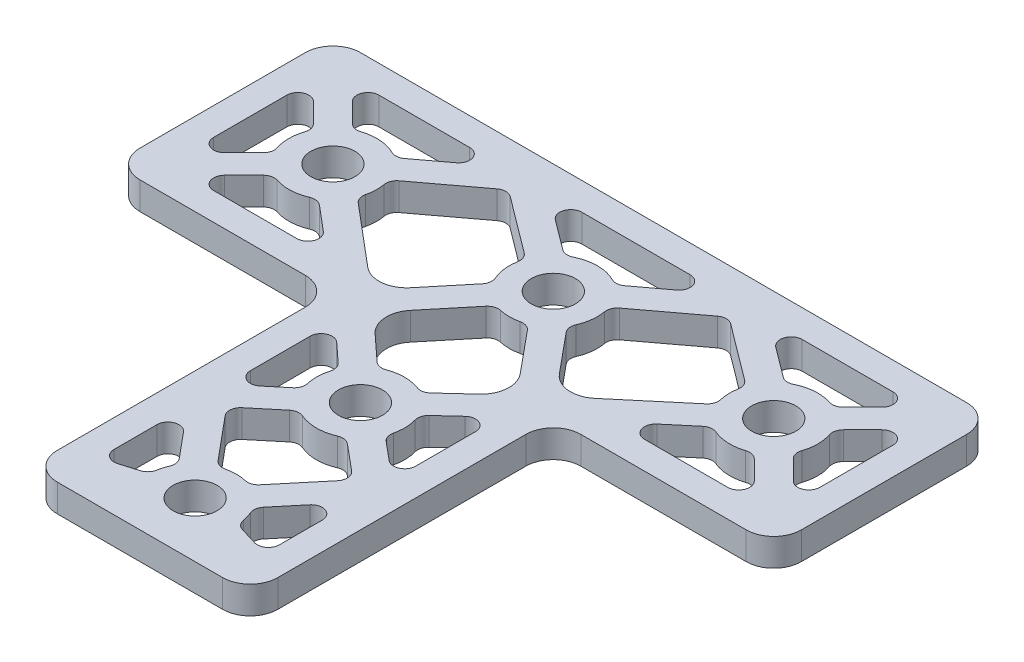
from build123d import *

# Parameters (mm, degrees)
SKETCH1_R           = 2.54
BOSS_EXTRUDE1_DEPTH = 3.175
CUT_EXTRUDE1_DEPTH  = 84.882514567
FILLET1_R           = 1.27
FILLET2_R           = 3.175


with BuildPart() as part:
    # Sketch1 → Boss-Extrude1 (new body)
    with BuildSketch(Plane(origin=(0, 0, 0), x_dir=(1, 0, 0), z_dir=(0, 1, 0))):
        with BuildLine():
            Line((0, 3.175), (0, 22.225))
            ThreePointArc((0, 22.225), (0.92993597, 24.47006403), (3.175, 25.4))
            Line((3.175, 25.4), (73.025, 25.4))
            ThreePointArc((73.025, 25.4), (75.27006403, 24.47006403), (76.2, 22.225))
            Line((76.2, 22.225), (76.2, 3.175))
            ThreePointArc((76.2, 3.175), (75.27006403, 0.92993597), (73.025, 0))
            Line((73.025, 0), (53.975, 0))
            ThreePointArc((53.975, 0), (51.72993597, -0.92993597), (50.8, -3.175))
            Line((50.8, -3.175), (50.8, -31.75))
            ThreePointArc((50.8, -31.75), (49.87006403, -33.99506403), (47.625, -34.925))
            Line((47.625, -34.925), (28.575, -34.925))
            ThreePointArc((28.575, -34.925), (26.32993597, -33.99506403), (25.4, -31.75))
            Line((25.4, -31.75), (25.4, -3.175))
            ThreePointArc((25.4, -3.175), (24.47006403, -0.92993597), (22.225, 0))
            Line((22.225, 0), (3.175, 0))
            ThreePointArc((3.175, 0), (0.92993597, 0.92993597), (0, 3.175))
        make_face()
        with Locations(Location((38.1, -9.525, 0), (0, 0, 270))):
            Circle(SKETCH1_R, mode=Mode.SUBTRACT)
        with Locations(Location((38.1, -28.575, 0), (0, 0, 270))):
            Circle(SKETCH1_R, mode=Mode.SUBTRACT)
        with Locations(Location((12.7, 12.7, 0), (0, 0, 270))):
            Circle(SKETCH1_R, mode=Mode.SUBTRACT)
        with Locations(Location((38.1, 12.7, 0), (0, 0, 270))):
            Circle(SKETCH1_R, mode=Mode.SUBTRACT)
        with Locations(Location((63.5, 12.7, 0), (0, 0, 270))):
            Circle(SKETCH1_R, mode=Mode.SUBTRACT)
    extrude(amount=BOSS_EXTRUDE1_DEPTH)

    # Sketch2 → Cut-Extrude1 (cut, through all)
    with BuildSketch(Plane(origin=(0, 3.175, 0), x_dir=(1, 0, 0), z_dir=(0, 1, 0))):
        with BuildLine():
            Line((28.575, -30.092601342), (33.021765741, -28.758571619))
            ThreePointArc((33.021765741, -28.758571619), (33.23547597, -27.428667372), (33.791186263, -26.201677788))
            Line((33.791186263, -26.201677788), (28.575, -19.942254272))
            Line((28.575, -19.942254272), (28.575, -30.092601342))
        make_face()
        with BuildLine():
            ThreePointArc((42.408813737, -26.201677788), (42.96452403, -27.428667372), (43.178234259, -28.758571619))
            Line((43.178234259, -28.758571619), (47.625, -30.092601342))
            Line((47.625, -30.092601342), (47.625, -19.942254272))
            Line((47.625, -19.942254272), (42.408813737, -26.201677788))
        make_face()
        with BuildLine():
            ThreePointArc((36.230288826, -24.169092319), (38.1, -23.8125), (39.969711174, -24.169092319))
            Line((39.969711174, -24.169092319), (45.389155984, -17.665758547))
            Line((45.389155984, -17.665758547), (40.790822212, -13.833813737))
            ThreePointArc((40.790822212, -13.833813737), (38.1, -14.605), (35.409177788, -13.833813737))
            Line((35.409177788, -13.833813737), (30.810844016, -17.665758547))
            Line((30.810844016, -17.665758547), (36.230288826, -24.169092319))
        make_face()
        with BuildLine():
            Line((28.575, -3.175), (28.575, -15.396038107))
            Line((28.575, -15.396038107), (33.376592319, -11.394711174))
            ThreePointArc((33.376592319, -11.394711174), (33.021594752, -9.397720235), (33.476184703, -7.421019939))
            Line((33.476184703, -7.421019939), (28.568882888, -2.896342676))
            ThreePointArc((28.568882888, -2.896342676), (28.573470538, -3.035637771), (28.575, -3.175))
        make_face()
        with BuildLine():
            Line((42.823407681, -11.394711174), (47.625, -15.396038107))
            Line((47.625, -15.396038107), (47.625, -3.175))
            ThreePointArc((47.625, -3.175), (47.626529462, -3.035637771), (47.631117112, -2.896342676))
            Line((47.631117112, -2.896342676), (42.723815297, -7.421019939))
            ThreePointArc((42.723815297, -7.421019939), (43.064644081, -8.44856647), (43.18, -9.525))
            ThreePointArc((43.18, -9.525), (43.090055662, -10.476706094), (42.823407681, -11.394711174))
        make_face()
        with BuildLine():
            Line((29.852647229, 0.238617187), (35.628403644, -5.086800877))
            ThreePointArc((35.628403644, -5.086800877), (38.1, -4.445), (40.571596356, -5.086800877))
            Line((40.571596356, -5.086800877), (46.347352771, 0.238617187))
            Line((46.347352771, 0.238617187), (39.952436997, 7.969791001))
            ThreePointArc((39.952436997, 7.969791001), (38.1, 7.62), (36.247563003, 7.969791001))
            Line((36.247563003, 7.969791001), (29.852647229, 0.238617187))
        make_face()
        with BuildLine():
            Line((17.413562252, 10.805605401), (27.468157851, 2.337260875))
            Line((27.468157851, 2.337260875), (33.801048645, 9.993449198))
            ThreePointArc((33.801048645, 9.993449198), (33.055389198, 12.101416788), (33.287034225, 14.325349331))
            Line((33.287034225, 14.325349331), (25.4, 20.240625))
            Line((25.4, 20.240625), (17.512965775, 14.325349331))
            ThreePointArc((17.512965775, 14.325349331), (17.712796931, 13.523569628), (17.78, 12.7))
            ThreePointArc((17.78, 12.7), (17.68754931, 11.735245171), (17.413562252, 10.805605401))
        make_face()
        with BuildLine():
            Line((22.754166667, 22.225), (5.42006403, 22.225))
            Line((5.42006403, 22.225), (10.410330105, 17.234733925))
            ThreePointArc((10.410330105, 17.234733925), (13.060116222, 17.767219781), (15.607965775, 16.865349331))
            Line((15.607965775, 16.865349331), (22.754166667, 22.225))
        make_face()
        with BuildLine():
            Line((3.175, 19.97993597), (3.175, 5.42006403))
            Line((3.175, 5.42006403), (8.165266075, 10.410330105))
            ThreePointArc((8.165266075, 10.410330105), (7.62, 12.7), (8.165266075, 14.989669895))
            Line((8.165266075, 14.989669895), (3.175, 19.97993597))
        make_face()
        with BuildLine():
            Line((5.42006403, 3.175), (21.54486045, 3.175))
            Line((21.54486045, 3.175), (15.368245204, 8.377169037))
            ThreePointArc((15.368245204, 8.377169037), (12.916922872, 7.624633563), (10.410330105, 8.165266075))
            Line((10.410330105, 8.165266075), (5.42006403, 3.175))
        make_face()
        with BuildLine():
            Line((42.398951355, 9.993449198), (48.731842149, 2.337260875))
            Line((48.731842149, 2.337260875), (58.786437748, 10.805605401))
            ThreePointArc((58.786437748, 10.805605401), (58.422024676, 12.556589386), (58.687034225, 14.325349331))
            Line((58.687034225, 14.325349331), (50.8, 20.240625))
            Line((50.8, 20.240625), (42.912965775, 14.325349331))
            ThreePointArc((42.912965775, 14.325349331), (43.112796931, 13.523569628), (43.18, 12.7))
            ThreePointArc((43.18, 12.7), (42.980833581, 11.291503086), (42.398951355, 9.993449198))
        make_face()
        with BuildLine():
            Line((28.045833333, 22.225), (35.192034225, 16.865349331))
            ThreePointArc((35.192034225, 16.865349331), (38.1, 17.78), (41.007965775, 16.865349331))
            Line((41.007965775, 16.865349331), (48.154166667, 22.225))
            Line((48.154166667, 22.225), (28.045833333, 22.225))
        make_face()
        with BuildLine():
            Line((53.445833333, 22.225), (60.592034225, 16.865349331))
            ThreePointArc((60.592034225, 16.865349331), (63.139883778, 17.767219781), (65.789669895, 17.234733925))
            Line((65.789669895, 17.234733925), (70.77993597, 22.225))
            Line((70.77993597, 22.225), (53.445833333, 22.225))
        make_face()
        with BuildLine():
            Line((60.831754796, 8.377169037), (54.65513955, 3.175))
            Line((54.65513955, 3.175), (70.77993597, 3.175))
            Line((70.77993597, 3.175), (65.789669895, 8.165266075))
            ThreePointArc((65.789669895, 8.165266075), (63.283077128, 7.624633563), (60.831754796, 8.377169037))
        make_face()
        with BuildLine():
            Line((68.034733925, 10.410330105), (73.025, 5.42006403))
            Line((73.025, 5.42006403), (73.025, 19.97993597))
            Line((73.025, 19.97993597), (68.034733925, 14.989669895))
            ThreePointArc((68.034733925, 14.989669895), (68.441803736, 13.876849961), (68.58, 12.7))
            ThreePointArc((68.58, 12.7), (68.441803736, 11.523150039), (68.034733925, 10.410330105))
        make_face()
    extrude(amount=-CUT_EXTRUDE1_DEPTH, mode=Mode.SUBTRACT)

    # Fillet1
    fillet1_edges = [part.edges().sort_by_distance(p)[0] for p in [
        (35.192034225, 1.5875, -16.865349331),
        (28.045833333, 1.5875, -22.225),
        (48.154166667, 1.5875, -22.225),
        (41.007965775, 1.5875, -16.865349331),
        (68.034733925, 1.5875, -14.989669895),
        (73.025, 1.5875, -19.97993597),
        (73.025, 1.5875, -5.42006403),
        (68.034733925, 1.5875, -10.410330105),
        (33.801048645, 1.5875, -9.993449198),
        (17.413562252, 1.5875, -10.805605401),
        (17.512965775, 1.5875, -14.325349331),
        (25.4, 1.5875, -20.240625),
        (33.287034225, 1.5875, -14.325349331),
        (15.368245204, 1.5875, -8.377169037),
        (21.54486045, 1.5875, -3.175),
        (5.42006403, 1.5875, -3.175),
        (10.410330105, 1.5875, -8.165266075),
        (42.408813737, 1.5875, 26.201677788),
        (47.625, 1.5875, 19.942254272),
        (47.625, 1.5875, 30.092601342),
        (43.178234259, 1.5875, 28.758571619),
        (47.625, 1.5875, 15.396038107),
        (42.823407681, 1.5875, 11.394711174),
        (42.723815297, 1.5875, 7.421019939),
        (47.631117112, 1.5875, 2.896342676),
        (28.568882888, 1.5875, 2.896342676),
        (33.476184703, 1.5875, 7.421019939),
        (33.376592319, 1.5875, 11.394711174),
        (28.575, 1.5875, 15.396038107),
        (8.165266075, 1.5875, -10.410330105),
        (3.175, 1.5875, -5.42006403),
        (8.165266075, 1.5875, -14.989669895),
        (36.230288826, 1.5875, 24.169092319),
        (30.810844016, 1.5875, 17.665758547),
        (35.409177788, 1.5875, 13.833813737),
        (40.790822212, 1.5875, 13.833813737),
        (45.389155984, 1.5875, 17.665758547),
        (39.969711174, 1.5875, 24.169092319),
        (65.789669895, 1.5875, -8.165266075),
        (70.77993597, 1.5875, -3.175),
        (54.65513955, 1.5875, -3.175),
        (60.831754796, 1.5875, -8.377169037),
        (33.021765741, 1.5875, 28.758571619),
        (28.575, 1.5875, 30.092601342),
        (28.575, 1.5875, 19.942254272),
        (33.791186263, 1.5875, 26.201677788),
        (35.628403644, 1.5875, 5.086800877),
        (36.247563003, 1.5875, -7.969791001),
        (39.952436997, 1.5875, -7.969791001),
        (40.571596356, 1.5875, 5.086800877),
        (10.410330105, 1.5875, -17.234733925),
        (5.42006403, 1.5875, -22.225),
        (22.754166667, 1.5875, -22.225),
        (15.607965775, 1.5875, -16.865349331),
        (60.592034225, 1.5875, -16.865349331),
        (53.445833333, 1.5875, -22.225),
        (70.77993597, 1.5875, -22.225),
        (65.789669895, 1.5875, -17.234733925),
        (58.786437748, 1.5875, -10.805605401),
        (42.398951355, 1.5875, -9.993449198),
        (42.912965775, 1.5875, -14.325349331),
        (50.8, 1.5875, -20.240625),
        (58.687034225, 1.5875, -14.325349331),
        (3.175, 1.5875, -19.97993597),
    ]]
    fillet(fillet1_edges, radius=FILLET1_R)

    # Fillet2
    fillet2_edges = [part.edges().sort_by_distance(p)[0] for p in [
        (27.468157851, 1.5875, -2.337260875),
        (29.852647229, 1.5875, -0.238617187),
        (46.347352771, 1.5875, -0.238617187),
        (48.731842149, 1.5875, -2.337260875),
    ]]
    fillet(fillet2_edges, radius=FILLET2_R)


solid = part.part
